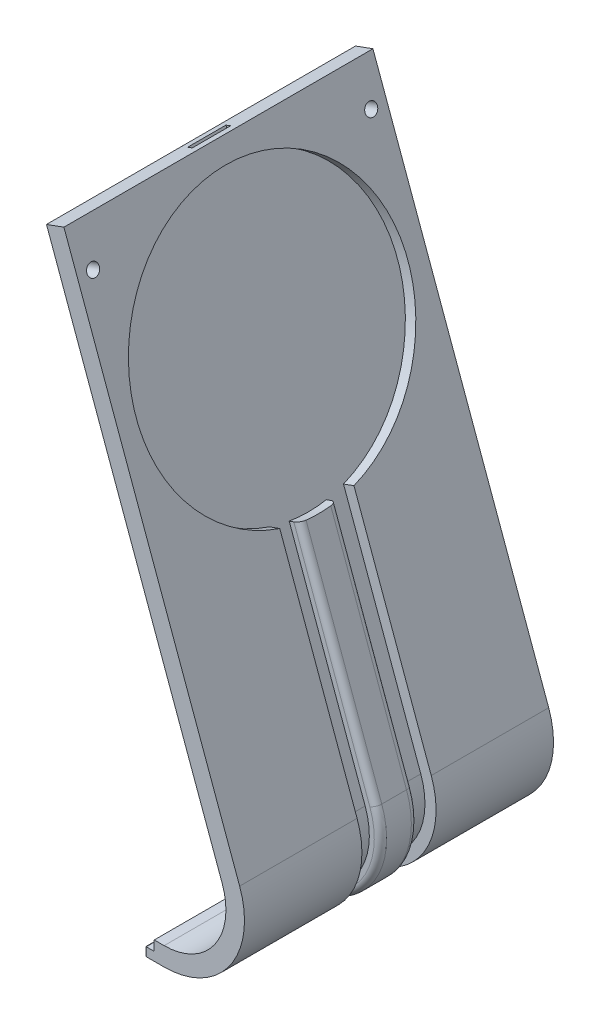
from build123d import *

# Parameters (mm, degrees)
EXTRUDE_1_DEPTH            = 25
SKETCH_4_R                 = 22
CUT_EXTRUDE_1_DEPTH        = 1.8
CUT_EXTRUDE_START          = 6
CUT_EXTRUDE_1_2_DEPTH      = 3
SKETCH_11_W                = 19
SKETCH_11_H                = 1.4
EXTRUDE_3_DEPTH            = 1.5
FILLET_1_R                 = 0.25
SKETCH_14_W                = 0.8
SKETCH_14_H                = 6.2
CUT_EXTRUDE_2_DEPTH        = 1
CUT_EXTRUDE_1_3_REACH      = 110.009
CUT_EXTRUDE_1_3_END_RADIUS = 11.2
SKETCH_15_W                = 2.85
SKETCH_15_H                = 12
FILLET_1_2_R               = 1
CUT_EXTRUDE_2_2_REACH      = 94.909
SKETCH_16_R                = 1


with BuildPart() as part:
    # 草图2 → 整体拉伸-薄壁1 (new, symmetric)
    with BuildSketch(Plane.XY):
        with BuildLine():
            Line((29.091335385, 6.904737634), (30.691335385, 6.904737634))
            ThreePointArc((30.691335385, 6.904737634), (38.882855828, 11.16897327), (40.088261593, 20.324939067))
            Line((40.088261593, 20.324939067), (11.65650271, 98.440554593))
            Line((11.65650271, 98.440554593), (14.475580572, 99.466615023))
            Line((14.475580572, 99.466615023), (42.907339455, 21.350999497))
            ThreePointArc((42.907339455, 21.350999497), (41.340311961, 9.448243961), (30.691335385, 3.904737634))
            Line((30.691335385, 3.904737634), (29.091335385, 3.904737634))
            Line((29.091335385, 3.904737634), (29.091335385, 6.904737634))
        make_face()
    extrude(amount=EXTRUDE_1_DEPTH, both=True)

    # 草图4 → Cut-Extrude 1 (cut)
    with BuildSketch(Plane(origin=(44.750213172, 16.287745572, 0), x_dir=(0, 0, -1), z_dir=(0.9396926207859071, 0.3420201433256726, 0))):
        with Locations(Location((0, 63.117104009, 0), (0, 0, 90))):
            Circle(SKETCH_4_R)
    extrude(amount=-CUT_EXTRUDE_1_DEPTH, mode=Mode.SUBTRACT)

    # 草图3 → Cut-Extrude 1 2 (cut)
    with BuildSketch(Plane.XY.offset(CUT_EXTRUDE_START)):
        with BuildLine():
            ThreePointArc((29.091335385, 5.819612465), (39.382240762, 9.840166611), (41.215892738, 20.735363239))
            Line((41.215892738, 20.735363239), (28.995888649, 54.30954854))
            Line((28.995888649, 54.30954854), (27.969828219, 57.128626402))
            Line((27.969828219, 57.128626402), (29.661274936, 57.74426266))
            Line((29.661274936, 57.74426266), (30.687335366, 54.925184798))
            Line((30.687335366, 54.925184798), (42.907339455, 21.350999497))
            ThreePointArc((42.907339455, 21.350999497), (40.778993412, 8.704789126), (28.834192528, 4.038074492))
            Line((28.834192528, 4.038074492), (29.091335385, 5.819612465))
        make_face()
    cut_extrude_1_2 = extrude(amount=-CUT_EXTRUDE_1_2_DEPTH, mode=Mode.SUBTRACT)

    # 镜向1: Cut-Extrude 1 2 across plane
    add(cut_extrude_1_2.mirror(Plane.XY), mode=Mode.SUBTRACT)

    # 草图11 → 底部卡扣凸台-拉伸3 (add)
    with BuildSketch(Plane.ZY.offset(-29.091335385)):
        with Locations((-15.5, 4.604737634)):
            Rectangle(SKETCH_11_W, SKETCH_11_H)
        with Locations((15.5, 4.604737634)):
            Rectangle(SKETCH_11_W, SKETCH_11_H)
    extrude(amount=EXTRUDE_3_DEPTH)

    # Fillet 1
    fillet_1_edges = [part.edges().sort_by_distance(p)[0] for p in [
        (27.591335385, 4.604737634, 6),
        (27.591335385, 3.904737634, 15.5),
        (27.591335385, 4.604737634, 25),
        (27.591335385, 5.304737634, 15.5),
        (27.591335385, 4.604737634, -25),
        (27.591335385, 3.904737634, -15.5),
        (27.591335385, 4.604737634, -6),
        (27.591335385, 5.304737634, -15.5),
    ]]
    fillet(fillet_1_edges, radius=FILLET_1_R)

    # 草图14 → Cut-Extrude 2 (cut)
    with BuildSketch(Plane(origin=(-30.2746326, 83.178869451, 0), x_dir=(0.9396926207859067, 0.3420201433256736, 0), z_dir=(-0.3420201433256736, 0.9396926207859068, 0))):
        with Locations((46.022182172, 0)):
            Rectangle(SKETCH_14_W, SKETCH_14_H)
    extrude(amount=-CUT_EXTRUDE_2_DEPTH, mode=Mode.SUBTRACT)

    # Cut-Extrude 1 3: up to this cylinder (the profile starts outside it)
    cut_extrude_1_3_end = Plane(origin=(30.691335385, 16.904737634, 0), z_dir=(0, 0, 1)) * Cylinder(CUT_EXTRUDE_1_3_END_RADIUS, 243.418, mode=Mode.PRIVATE)
    # 草图15 → Cut-Extrude 1 3 (cut, up to the surface)
    with BuildSketch(Plane.XZ.offset(-3.904737634), mode=Mode.PRIVATE) as cut_extrude_1_3_sk1:
        with Locations((29.266335385, 0)):
            Rectangle(SKETCH_15_W, SKETCH_15_H)
    cut_extrude_1_3_tool1 = extrude(cut_extrude_1_3_sk1.sketch, amount=-CUT_EXTRUDE_1_3_REACH, mode=Mode.PRIVATE) - cut_extrude_1_3_end
    add(cut_extrude_1_3_tool1.solids().sort_by_distance((29.266335, 3.904738, 0))[0], mode=Mode.SUBTRACT)

    # Fillet 1 2
    fillet_1_2_edges = [part.edges().sort_by_distance(p)[0] for p in [
        (30.691335385, 3.904737634, 0),
        (36.762193938, 38.234648046, 3),
        (41.340311961, 9.448243961, 3),
        (41.340311961, 9.448243961, -3),
        (36.762193938, 38.234648046, -3),
    ]]
    fillet(fillet_1_2_edges, radius=FILLET_1_2_R)

    # 草图16 → Cut-Extrude 2 2 (cut, up to next)
    with BuildSketch(Plane(origin=(41.93113531, 15.261685142, 0), x_dir=(0, 0, 1), z_dir=(-0.9396926207859069, -0.3420201433256731, 0)), mode=Mode.PRIVATE) as cut_extrude_2_2_sk1:
        with Locations(Location((-22.5, 82.017104009, 0), (0, 0, 270))):
            Circle(SKETCH_16_R)
    cut_extrude_2_2_tool1 = extrude(cut_extrude_2_2_sk1.sketch, amount=-CUT_EXTRUDE_2_2_REACH, mode=Mode.PRIVATE) & part.part
    # 草图16 → Cut-Extrude 2 2 (cut, up to next)
    with BuildSketch(Plane(origin=(41.93113531, 15.261685142, 0), x_dir=(0, 0, 1), z_dir=(-0.9396926207859069, -0.3420201433256731, 0)), mode=Mode.PRIVATE) as cut_extrude_2_2_sk2:
        with Locations(Location((22.5, 82.017104009, 0), (0, 0, 270))):
            Circle(SKETCH_16_R)
    cut_extrude_2_2_tool2 = extrude(cut_extrude_2_2_sk2.sketch, amount=-CUT_EXTRUDE_2_2_REACH, mode=Mode.PRIVATE) & part.part
    add(cut_extrude_2_2_tool1.solids().sort_by_distance((13.879634, 92.332553, -22.5))[0], mode=Mode.SUBTRACT)
    add(cut_extrude_2_2_tool2.solids().sort_by_distance((13.879634, 92.332553, 22.5))[0], mode=Mode.SUBTRACT)


solid = part.part
